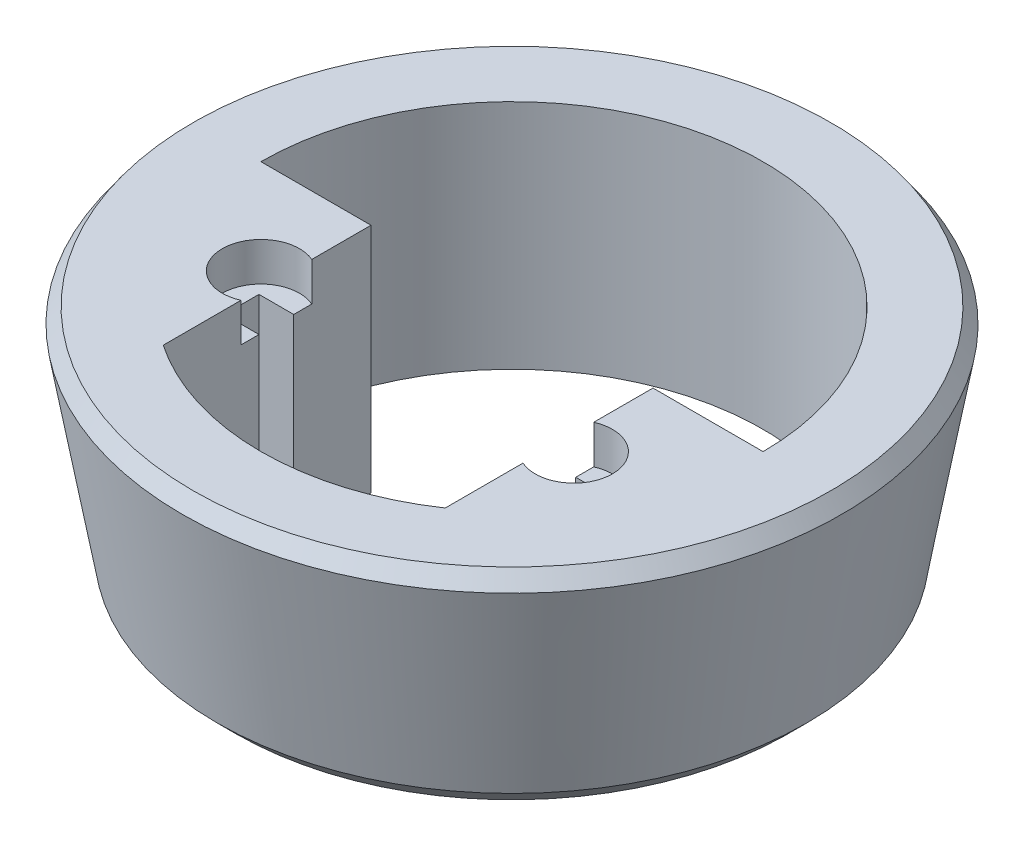
from build123d import *
from OCP.BRepFilletAPI import BRepFilletAPI_MakeChamfer

# Parameters (mm, degrees)
CUT_EXTRUDE1_DEPTH = 28.123421613
SKETCH3_R          = 2
CUT_EXTRUDE2_DEPTH = 2
CHAMFER1_SIZE      = 0.8
CHAMFER1_SIZE2     = 0.984433479
CHAMFER1_SIZE2_2   = 0.691197975


with BuildPart() as part:
    # Sketch1 → Revolve1 (revolve)
    with BuildSketch(Plane.XY, mode=Mode.PRIVATE) as revolve1_sk:
        Polygon((0, 0), (-17.2, 0), (-15.1, -12), (0, -12), align=None)
    revolve(revolve1_sk.sketch.rotate(Axis((0, 0, 0), (0, -1, 0)), 270), axis=Axis((0, 0, 0), (0, -1, 0)))

    # Sketch2 → Cut-Extrude1 (cut, through all)
    with BuildSketch(Plane(origin=(0, 0, 0), x_dir=(1, 0, 0), z_dir=(0, 1, 0))):
        with BuildLine():
            Line((-9.1, -5.8), (-7.3, -5.8))
            Line((-7.3, -5.8), (-7.3, -10.756858277))
            ThreePointArc((-7.3, -10.756858277), (0, -13), (7.3, -10.756858277))
            Line((7.3, -10.756858277), (7.3, -5.8))
            Line((7.3, -5.8), (9.1, -5.8))
            Line((9.1, -5.8), (9.1, -4))
            Line((9.1, -4), (7.3, -4))
            Line((7.3, -4), (7.3, 0))
            Line((7.3, 0), (13, 0))
            ThreePointArc((13, 0), (0, 13), (-13, 0))
            Line((-13, 0), (-7.3, 0))
            Line((-7.3, 0), (-7.3, -4))
            Line((-7.3, -4), (-9.1, -4))
            Line((-9.1, -4), (-9.1, -5.8))
        make_face()
    extrude(amount=-CUT_EXTRUDE1_DEPTH, mode=Mode.SUBTRACT)

    # Sketch3 → Cut-Extrude2 (cut)
    with BuildSketch(Plane(origin=(0, 0, 0), x_dir=(1, 0, 0), z_dir=(0, 1, 0))):
        with Locations((-8.1, -4.9)):
            Circle(SKETCH3_R)
        with Locations((8.1, -4.9)):
            Circle(SKETCH3_R)
    extrude(amount=-CUT_EXTRUDE2_DEPTH, mode=Mode.SUBTRACT)

    # Chamfer1: one chamfer whose edges measure the first distance from different faces: ONE call of the kernel's chamfer builder (chamfer() names one face for all edges)
    chamfer1_edges_1 = [part.edges().sort_by_distance(p)[0] for p in [
        (0, -12, -15.1),
    ]]
    chamfer1_side_1 = [part.faces().sort_by_distance(p)[0] for p in [
        (0, -12, -14.672907504),
    ]]
    chamfer1_edges_2 = [part.edges().sort_by_distance(p)[0] for p in [
        (0, 0, -17.2),
    ]]
    chamfer1_side_2 = [part.faces().sort_by_distance(p)[0] for p in [
        (0, -6, -16.15),
    ]]
    chamfer1 = BRepFilletAPI_MakeChamfer(part.part.solid().wrapped)
    for e in chamfer1_edges_1:
        chamfer1.Add(CHAMFER1_SIZE, CHAMFER1_SIZE2, e.wrapped, chamfer1_side_1[0].wrapped)  # the first distance lies on this face
    for e in chamfer1_edges_2:
        chamfer1.Add(CHAMFER1_SIZE, CHAMFER1_SIZE2_2, e.wrapped, chamfer1_side_2[0].wrapped)  # the first distance lies on this face
    add(Compound.cast(chamfer1.Shape()), mode=Mode.REPLACE)


solid = part.part
